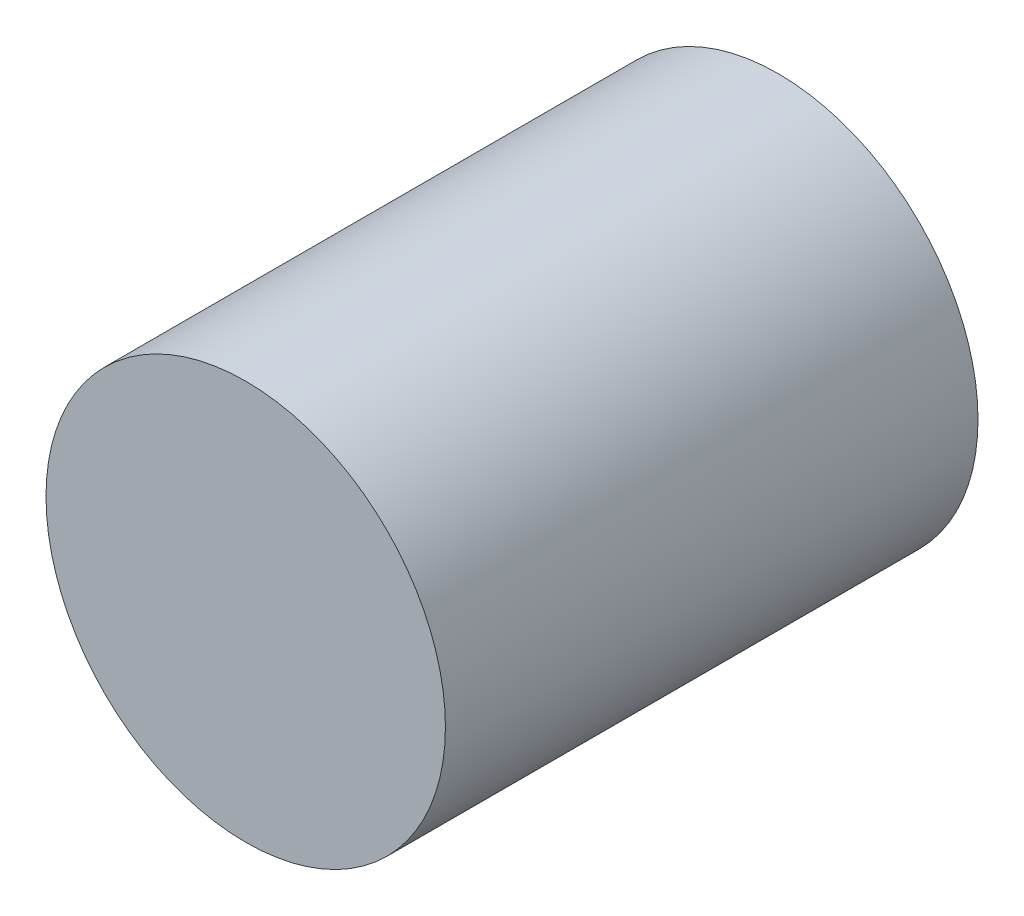
from build123d import *

# Parameters (mm, degrees)
SKETCH3_R           = 0.75
BOSS_EXTRUDE1_DEPTH = 2


with BuildPart() as part:
    # Sketch3 → Boss-Extrude1 (new body)
    with BuildSketch(Plane.XY):
        Circle(SKETCH3_R)
    extrude(amount=BOSS_EXTRUDE1_DEPTH)


solid = part.part
